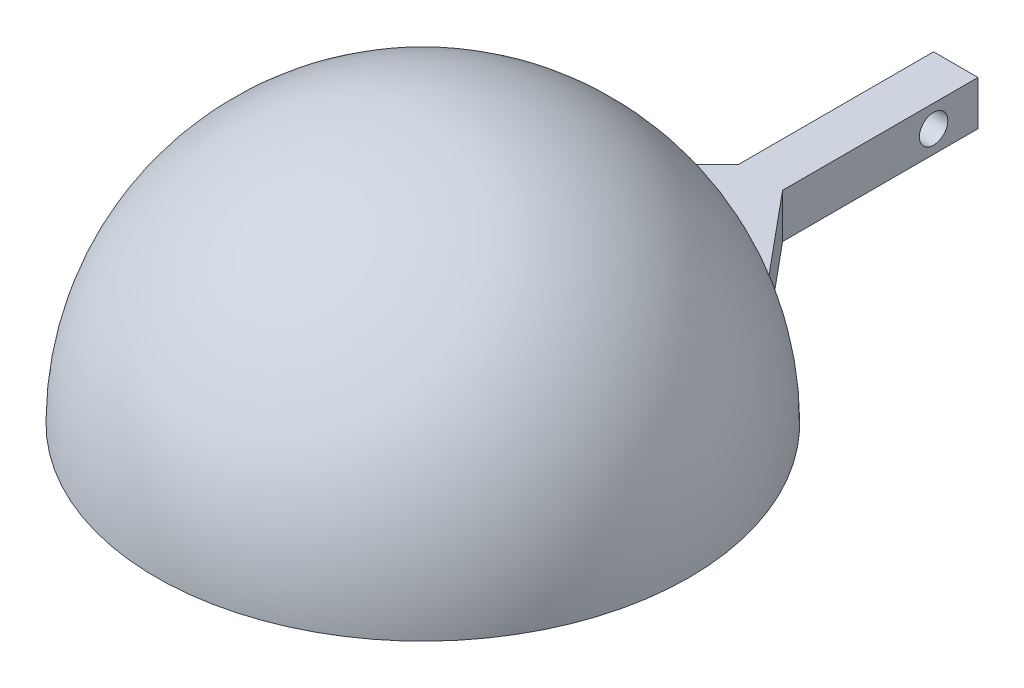
from build123d import *

# Parameters (mm, degrees)
BOSS_EXTRUDE1_DEPTH      = 5
SKETCH4_R                = 1.6
CUT_EXTRUDE1_DEPTH       = 75.540257579
BOSS_EXTRUDE2_REACH      = 75.485
BOSS_EXTRUDE2_END_RADIUS = 29
SKETCH5_W                = 2
SKETCH5_H                = 45
SKETCH5_W_2              = 45
SKETCH5_H_2              = 2
BOSS_EXTRUDE3_REACH      = 69.5
BOSS_EXTRUDE3_END_RADIUS = 29
SKETCH7_W                = 2
SKETCH7_H                = 3
CIRPATTERN1_COUNT        = 4


with BuildPart() as part:
    # Sketch2 → Revolve1 (revolve)
    with BuildSketch(Plane.XY):
        with BuildLine():
            Line((0, 29), (0, 30))
            ThreePointArc((0, 30), (21.213203436, 21.213203436), (30, 0))
            Line((30, 0), (29, 0))
            ThreePointArc((29, 0), (20.506096654, 20.506096654), (0, 29))
        make_face()
    revolve(axis=Axis((0, 0, 0), (0, 1, 0)))

    # Sketch3 → Boss-Extrude1 (add)
    with BuildSketch(Plane.XZ):
        with BuildLine():
            Line((-2.5, -38), (-2.5, -60))
            Line((-2.5, -60), (2.5, -60))
            Line((2.5, -60), (2.5, -38))
            Line((2.5, -38), (12.22277757, -26.308006594))
            Line((12.22277757, -26.308006594), (12.219091313, -26.300072385))
            ThreePointArc((12.219091313, -26.300072385), (-0.967100454, -29.109666297), (-13.937737405, -25.431073041))
            Line((-13.937737405, -25.431073041), (-14.41834904, -26.308006594))
            Line((-14.41834904, -26.308006594), (-2.5, -38))
        make_face()
    extrude(amount=-BOSS_EXTRUDE1_DEPTH)

    # Sketch4 → Cut-Extrude1 (cut, through all)
    with BuildSketch(Plane(origin=(2.5, 0, 0), x_dir=(0, 0, -1), z_dir=(1, 0, 0))):
        with Locations((55, 2.5)):
            Circle(SKETCH4_R)
    extrude(amount=-CUT_EXTRUDE1_DEPTH, mode=Mode.SUBTRACT)

    # Boss-Extrude2: up to this sphere (the profile starts inside it)
    boss_extrude2_end = Location((0, 0, 0)) * Sphere(BOSS_EXTRUDE2_END_RADIUS, mode=Mode.PRIVATE)
    # Sketch5 → Boss-Extrude2 (add, up to the surface)
    with BuildSketch(Plane(origin=(0, 0, 0), x_dir=(1, 0, 0), z_dir=(0, 1, 0)), mode=Mode.PRIVATE) as boss_extrude2_sk1:
        Rectangle(SKETCH5_W, SKETCH5_H)
    boss_extrude2_tool1 = extrude(boss_extrude2_sk1.sketch, amount=BOSS_EXTRUDE2_REACH, mode=Mode.PRIVATE) & boss_extrude2_end
    add(boss_extrude2_tool1.solids().sort_by_distance((0, 0, 0))[0])
    # Sketch5 → Boss-Extrude2 (add, up to the surface)
    with BuildSketch(Plane(origin=(0, 0, 0), x_dir=(1, 0, 0), z_dir=(0, 1, 0)), mode=Mode.PRIVATE) as boss_extrude2_sk2:
        with Locations((0, -0.008687273)):
            Rectangle(SKETCH5_W_2, SKETCH5_H_2)
    boss_extrude2_tool2 = extrude(boss_extrude2_sk2.sketch, amount=BOSS_EXTRUDE2_REACH, mode=Mode.PRIVATE) & boss_extrude2_end
    add(boss_extrude2_tool2.solids().sort_by_distance((0, 0, 0.008687))[0])

    # Boss-Extrude3: up to this sphere (the profile starts inside it)
    boss_extrude3_end = Location((0, 0, 0)) * Sphere(BOSS_EXTRUDE3_END_RADIUS, mode=Mode.PRIVATE)
    # Sketch7 → Boss-Extrude3 (add, up to the surface)
    with BuildSketch(Plane(origin=(0, 0, -22.5), x_dir=(-1, 0, 0), z_dir=(0, 0, -1)), mode=Mode.PRIVATE) as boss_extrude3_sk1:
        with Locations((0, 1.5)):
            Rectangle(SKETCH7_W, SKETCH7_H)
    boss_extrude3_tool1 = extrude(boss_extrude3_sk1.sketch, amount=BOSS_EXTRUDE3_REACH, mode=Mode.PRIVATE) & boss_extrude3_end
    boss_extrude3 = boss_extrude3_tool1.solids().sort_by_distance((0, 1.5, -22.5))[0]
    add(boss_extrude3)

    # CirPattern1: Boss-Extrude3 ×4 about axis
    cirpattern1_axis = Axis((0, 0, 0), (0, -1, 0))
    for i in range(1, CIRPATTERN1_COUNT):
        add(boss_extrude3.rotate(cirpattern1_axis, i * 360 / CIRPATTERN1_COUNT))


solid = part.part
